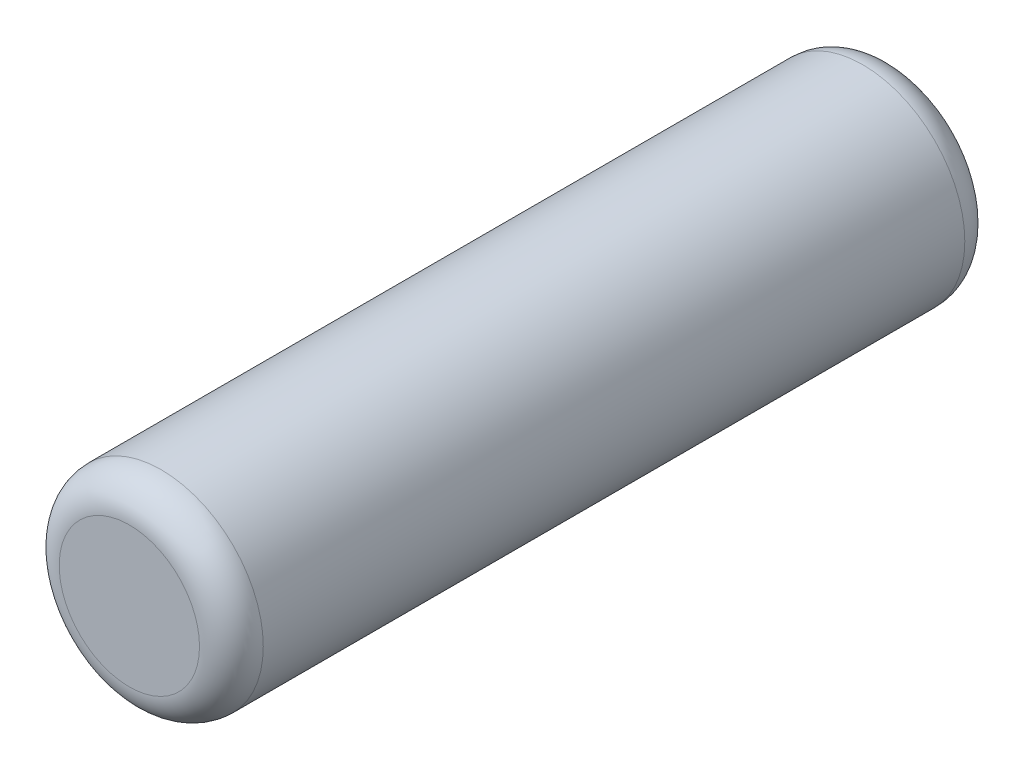
from build123d import *

# Parameters (mm, degrees)
SKETCH_1_R      = 3.2
EXTRUDE_1_DEPTH = 24
FILLET_1_R      = 1


with BuildPart() as part:
    # 스케치1 → 보스-돌출1 (new body)
    with BuildSketch(Plane.XY):
        Circle(SKETCH_1_R)
    extrude(amount=EXTRUDE_1_DEPTH)

    # 필렛1
    fillet_1_edges = [part.edges().sort_by_distance(p)[0] for p in [
        (-3.2, 0, 0),
        (-3.2, 0, 24),
    ]]
    fillet(fillet_1_edges, radius=FILLET_1_R)


solid = part.part
